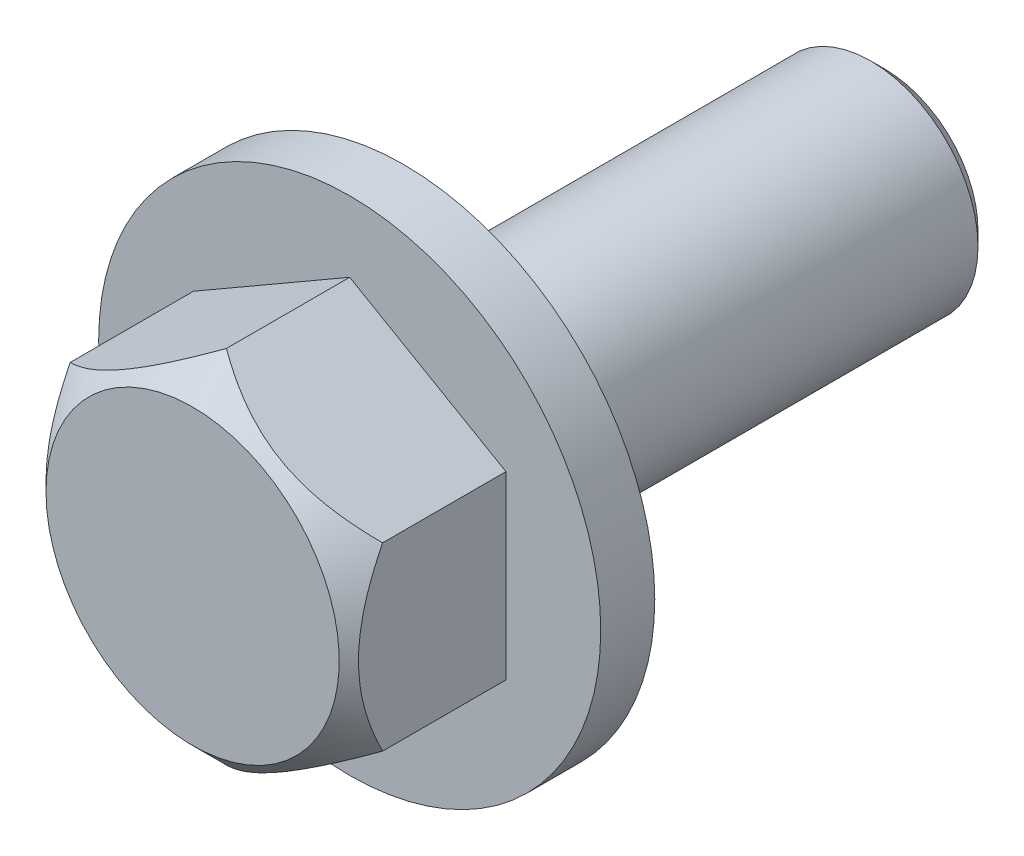
from build123d import *

# Parameters (mm, degrees)
BOSS_EXTRUDE2_DEPTH = 9.3


with BuildPart() as part:
    # Sketch6 → Boss-Extrude2 (new body)
    with BuildSketch(Plane.XY):
        Polygon((0, 10.68097998), (-9.25, 5.34048999), (-9.25, -5.34048999), (0, -10.68097998), (9.25, -5.34048999), (9.25, 5.34048999), align=None)
    extrude(amount=BOSS_EXTRUDE2_DEPTH)

    # Sketch8 → Cut-Revolve1 (revolve, cut)
    with BuildSketch(Plane(origin=(0, 0, 0), x_dir=(0, 0, -1), z_dir=(1, 0, 0)), mode=Mode.PRIVATE) as cut_revolve1_sk:
        Polygon((-7.3, 10.68097998), (-9.3, 8.68097998), (-9.3, 10.68097998), align=None)
    revolve(cut_revolve1_sk.sketch.rotate(Axis((0, 0, 0), (0, 0, 1)), 90), axis=Axis((0, 0, 0), (0, 0, 1)), mode=Mode.SUBTRACT)

    # Sketch10 → Revolve1 (revolve)
    with BuildSketch(Plane(origin=(0, 0, 0), x_dir=(0, 0, -1), z_dir=(1, 0, 0))):
        Polygon((0, 0), (0, 14.863694745), (3.2, 14.863694745), (3.2, 6.35), (30.851471863, 6.35), (31.7, 5.501471863), (31.7, 0), align=None)
    revolve(axis=Axis((0, 0, -31.7), (0, 0, 1)))


solid = part.part
